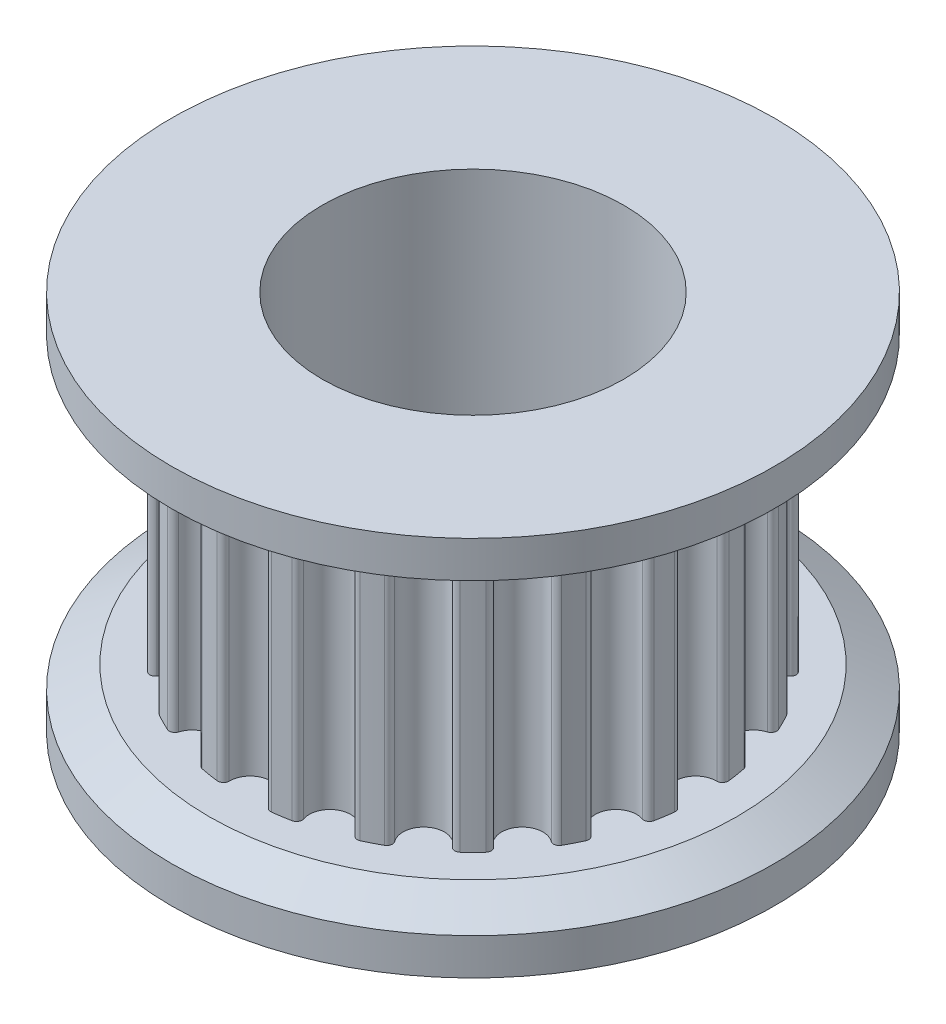
from build123d import *
from OCP.BRepFilletAPI import BRepFilletAPI_MakeChamfer

# Parameters (mm, degrees)
SKETCH_1_R               = 8
SKETCH_1_R_2             = 2.5
EXTRUDE_1_DEPTH          = 7.45
SKETCH_2_R               = 2.5
EXTRUDE_2_DEPTH          = 7
SKETCH_3_R               = 8
SKETCH_3_R_2             = 2.5
EXTRUDE_3_DEPTH          = 1.55
CUT_EXTRUDE_1_REACH      = 21.596
CUT_EXTRUDE_1_END_RADIUS = 8
SKETCH_4_R               = 1.25
CUT_EXTRUDE_2_REACH      = 21.596
CUT_EXTRUDE_2_END_RADIUS = 8
SKETCH_5_R               = 1.25
CHAMFER_1_SIZE           = 1
CHAMFER_1_SIZE2          = 0.577350269
ESBO_O1_R                = 8
CORTE_EXTRUS_O1_DEPTH    = 5.9
ESBO_O2_R                = 4
CORTE_EXTRUS_O2_DEPTH    = 10.1


with BuildPart() as part:
    # Эскиз1 → Бобышка-Вытянуть1 (new body)
    with BuildSketch(Plane(origin=(0, 0, 0), x_dir=(1, 0, 0), z_dir=(0, 1, 0))):
        with Locations(Location((0, 0, 0), (0, 0, 270))):
            Circle(SKETCH_1_R)
        with Locations(Location((0, 0, 0), (0, 0, 270))):
            Circle(SKETCH_1_R_2, mode=Mode.SUBTRACT)
    extrude(amount=EXTRUDE_1_DEPTH)

    # Эскиз2 → Бобышка-Вытянуть2 (add)
    with BuildSketch(Plane(origin=(0, 7.45, 0), x_dir=(1, 0, 0), z_dir=(0, 1, 0))):
        with BuildLine():
            ThreePointArc((-2.557469435, 5.549004423), (-2.773881953, 5.444049863), (-2.985996064, 5.3306592))
            ThreePointArc((-2.985996064, 5.3306592), (-3.059404709, 5.231014138), (-3.032930262, 5.110113057))
            ThreePointArc((-3.032930262, 5.110113057), (-3.150528952, 4.33633109), (-3.922779328, 4.463599867))
            ThreePointArc((-3.922779328, 4.463599867), (-4.029582035, 4.526139051), (-4.14703464, 4.487115298))
            ThreePointArc((-4.14703464, 4.487115298), (-4.320422433, 4.320422433), (-4.487115298, 4.14703464))
            ThreePointArc((-4.487115298, 4.14703464), (-4.526139051, 4.029582035), (-4.463599867, 3.922779328))
            ThreePointArc((-4.463599867, 3.922779328), (-4.33633109, 3.150528952), (-5.110113057, 3.032930262))
            ThreePointArc((-5.110113057, 3.032930262), (-5.231014138, 3.059404709), (-5.3306592, 2.985996064))
            ThreePointArc((-5.3306592, 2.985996064), (-5.444049863, 2.773881953), (-5.549004423, 2.557469435))
            ThreePointArc((-5.549004423, 2.557469435), (-5.549823367, 2.433706366), (-5.457341217, 2.351456627))
            ThreePointArc((-5.457341217, 2.351456627), (-5.097662927, 1.65633109), (-5.797233315, 1.305376312))
            ThreePointArc((-5.797233315, 1.305376312), (-5.92039813, 1.293194518), (-5.992481697, 1.19258673))
            ThreePointArc((-5.992481697, 1.19258673), (-6.034775761, 0.955814581), (-6.067718334, 0.717561302))
            ThreePointArc((-6.067718334, 0.717561302), (-6.030252304, 0.599602562), (-5.916879985, 0.549956967))
            ThreePointArc((-5.916879985, 0.549956967), (-5.36, 0), (-5.916879985, -0.549956967))
            ThreePointArc((-5.916879985, -0.549956967), (-6.030252304, -0.599602562), (-6.067718334, -0.717561302))
            ThreePointArc((-6.067718334, -0.717561302), (-6.034775761, -0.955814581), (-5.992481697, -1.19258673))
            ThreePointArc((-5.992481697, -1.19258673), (-5.92039813, -1.293194518), (-5.797233315, -1.305376312))
            ThreePointArc((-5.797233315, -1.305376312), (-5.097662927, -1.65633109), (-5.457341217, -2.351456627))
            ThreePointArc((-5.457341217, -2.351456627), (-5.549823367, -2.433706366), (-5.549004423, -2.557469435))
            ThreePointArc((-5.549004423, -2.557469435), (-5.444049863, -2.773881953), (-5.3306592, -2.985996064))
            ThreePointArc((-5.3306592, -2.985996064), (-5.231014138, -3.059404709), (-5.110113057, -3.032930262))
            ThreePointArc((-5.110113057, -3.032930262), (-4.33633109, -3.150528952), (-4.463599867, -3.922779328))
            ThreePointArc((-4.463599867, -3.922779328), (-4.526139051, -4.029582035), (-4.487115298, -4.14703464))
            ThreePointArc((-4.487115298, -4.14703464), (-4.320422433, -4.320422433), (-4.14703464, -4.487115298))
            ThreePointArc((-4.14703464, -4.487115298), (-4.029582035, -4.526139051), (-3.922779328, -4.463599867))
            ThreePointArc((-3.922779328, -4.463599867), (-3.150528952, -4.33633109), (-3.032930262, -5.110113057))
            ThreePointArc((-3.032930262, -5.110113057), (-3.059404709, -5.231014138), (-2.985996064, -5.3306592))
            ThreePointArc((-2.985996064, -5.3306592), (-2.773881953, -5.444049863), (-2.557469435, -5.549004423))
            ThreePointArc((-2.557469435, -5.549004423), (-2.433706366, -5.549823367), (-2.351456627, -5.457341217))
            ThreePointArc((-2.351456627, -5.457341217), (-1.65633109, -5.097662927), (-1.305376312, -5.797233315))
            ThreePointArc((-1.305376312, -5.797233315), (-1.293194518, -5.92039813), (-1.19258673, -5.992481697))
            ThreePointArc((-1.19258673, -5.992481697), (-0.955814581, -6.034775761), (-0.717561302, -6.067718334))
            ThreePointArc((-0.717561302, -6.067718334), (-0.599602562, -6.030252304), (-0.549956967, -5.916879985))
            ThreePointArc((-0.549956967, -5.916879985), (0, -5.36), (0.549956967, -5.916879985))
            ThreePointArc((0.549956967, -5.916879985), (0.599602562, -6.030252304), (0.717561302, -6.067718334))
            ThreePointArc((0.717561302, -6.067718334), (0.955814581, -6.034775761), (1.19258673, -5.992481697))
            ThreePointArc((1.19258673, -5.992481697), (1.293194518, -5.92039813), (1.305376312, -5.797233315))
            ThreePointArc((1.305376312, -5.797233315), (1.65633109, -5.097662927), (2.351456627, -5.457341217))
            ThreePointArc((2.351456627, -5.457341217), (2.433706366, -5.549823367), (2.557469435, -5.549004423))
            ThreePointArc((2.557469435, -5.549004423), (2.773881953, -5.444049863), (2.985996064, -5.3306592))
            ThreePointArc((2.985996064, -5.3306592), (3.059404709, -5.231014138), (3.032930262, -5.110113057))
            ThreePointArc((3.032930262, -5.110113057), (3.150528952, -4.33633109), (3.922779328, -4.463599867))
            ThreePointArc((3.922779328, -4.463599867), (4.029582035, -4.526139051), (4.14703464, -4.487115298))
            ThreePointArc((4.14703464, -4.487115298), (4.320422433, -4.320422433), (4.487115298, -4.14703464))
            ThreePointArc((4.487115298, -4.14703464), (4.526139051, -4.029582035), (4.463599867, -3.922779328))
            ThreePointArc((4.463599867, -3.922779328), (4.33633109, -3.150528952), (5.110113057, -3.032930262))
            ThreePointArc((5.110113057, -3.032930262), (5.231014138, -3.059404709), (5.3306592, -2.985996064))
            ThreePointArc((5.3306592, -2.985996064), (5.444049863, -2.773881953), (5.549004423, -2.557469435))
            ThreePointArc((5.549004423, -2.557469435), (5.549823367, -2.433706366), (5.457341217, -2.351456627))
            ThreePointArc((5.457341217, -2.351456627), (5.097662927, -1.65633109), (5.797233315, -1.305376312))
            ThreePointArc((5.797233315, -1.305376312), (5.92039813, -1.293194518), (5.992481697, -1.19258673))
            ThreePointArc((5.992481697, -1.19258673), (6.034775761, -0.955814581), (6.067718334, -0.717561302))
            ThreePointArc((6.067718334, -0.717561302), (6.030252304, -0.599602562), (5.916879985, -0.549956967))
            ThreePointArc((5.916879985, -0.549956967), (5.36, 0), (5.916879985, 0.549956967))
            ThreePointArc((5.916879985, 0.549956967), (6.030252304, 0.599602562), (6.067718334, 0.717561302))
            ThreePointArc((6.067718334, 0.717561302), (6.034775761, 0.955814581), (5.992481697, 1.19258673))
            ThreePointArc((5.992481697, 1.19258673), (5.92039813, 1.293194518), (5.797233315, 1.305376312))
            ThreePointArc((5.797233315, 1.305376312), (5.097662927, 1.65633109), (5.457341217, 2.351456627))
            ThreePointArc((5.457341217, 2.351456627), (5.549823367, 2.433706366), (5.549004423, 2.557469435))
            ThreePointArc((5.549004423, 2.557469435), (5.444049863, 2.773881953), (5.3306592, 2.985996064))
            ThreePointArc((5.3306592, 2.985996064), (5.231014138, 3.059404709), (5.110113057, 3.032930262))
            ThreePointArc((5.110113057, 3.032930262), (4.33633109, 3.150528952), (4.463599867, 3.922779328))
            ThreePointArc((4.463599867, 3.922779328), (4.526139051, 4.029582035), (4.487115298, 4.14703464))
            ThreePointArc((4.487115298, 4.14703464), (4.320422433, 4.320422433), (4.14703464, 4.487115298))
            ThreePointArc((4.14703464, 4.487115298), (4.029582035, 4.526139051), (3.922779328, 4.463599867))
            ThreePointArc((3.922779328, 4.463599867), (3.150528952, 4.33633109), (3.032930262, 5.110113057))
            ThreePointArc((3.032930262, 5.110113057), (3.059404709, 5.231014138), (2.985996064, 5.3306592))
            ThreePointArc((2.985996064, 5.3306592), (2.773881953, 5.444049863), (2.557469435, 5.549004423))
            ThreePointArc((2.557469435, 5.549004423), (2.433706366, 5.549823367), (2.351456627, 5.457341217))
            ThreePointArc((2.351456627, 5.457341217), (1.65633109, 5.097662927), (1.305376312, 5.797233315))
            ThreePointArc((1.305376312, 5.797233315), (1.293194518, 5.92039813), (1.19258673, 5.992481697))
            ThreePointArc((1.19258673, 5.992481697), (0.955814581, 6.034775761), (0.717561302, 6.067718334))
            ThreePointArc((0.717561302, 6.067718334), (0.599602562, 6.030252304), (0.549956967, 5.916879985))
            ThreePointArc((0.549956967, 5.916879985), (0, 5.36), (-0.549956967, 5.916879985))
            ThreePointArc((-0.549956967, 5.916879985), (-0.599602562, 6.030252304), (-0.717561302, 6.067718334))
            ThreePointArc((-0.717561302, 6.067718334), (-0.955814581, 6.034775761), (-1.19258673, 5.992481697))
            ThreePointArc((-1.19258673, 5.992481697), (-1.293194518, 5.92039813), (-1.305376312, 5.797233315))
            ThreePointArc((-1.305376312, 5.797233315), (-1.65633109, 5.097662927), (-2.351456627, 5.457341217))
            ThreePointArc((-2.351456627, 5.457341217), (-2.433706366, 5.549823367), (-2.557469435, 5.549004423))
        make_face()
        with Locations(Location((0, 0, 0), (0, 0, 270))):
            Circle(SKETCH_2_R, mode=Mode.SUBTRACT)
    extrude(amount=EXTRUDE_2_DEPTH)

    # Эскиз3 → Бобышка-Вытянуть3 (add)
    with BuildSketch(Plane(origin=(0, 14.45, 0), x_dir=(1, 0, 0), z_dir=(0, 1, 0))):
        with Locations(Location((0, 0, 0), (0, 0, 270))):
            Circle(SKETCH_3_R)
        with Locations(Location((0, 0, 0), (0, 0, 270))):
            Circle(SKETCH_3_R_2, mode=Mode.SUBTRACT)
    extrude(amount=EXTRUDE_3_DEPTH)

    # Вырез-Вытянуть1: up to this cylinder (the profile starts inside it)
    cut_extrude_1_end = Plane(origin=(0, 3.725, 0), z_dir=(0, -1, 0)) * Cylinder(CUT_EXTRUDE_1_END_RADIUS, 60.192, mode=Mode.PRIVATE)
    # Эскиз4 → Вырез-Вытянуть1 (cut, up to the surface)
    with BuildSketch(Plane.XY, mode=Mode.PRIVATE) as cut_extrude_1_sk1:
        with Locations(Location((0, 3.725, 0), (0, 0, 180))):
            Circle(SKETCH_4_R)
    cut_extrude_1_tool1 = extrude(cut_extrude_1_sk1.sketch, amount=CUT_EXTRUDE_1_REACH, mode=Mode.PRIVATE) & cut_extrude_1_end
    add(cut_extrude_1_tool1.solids().sort_by_distance((0, 3.725, 0))[0], mode=Mode.SUBTRACT)

    # Вырез-Вытянуть2: up to this cylinder (the profile starts inside it)
    cut_extrude_2_end = Plane(origin=(0, 3.725, 0), z_dir=(0, -1, 0)) * Cylinder(CUT_EXTRUDE_2_END_RADIUS, 60.192, mode=Mode.PRIVATE)
    # Эскиз5 → Вырез-Вытянуть2 (cut, up to the surface)
    with BuildSketch(Plane(origin=(0, 0, 0), x_dir=(0, 0, -1), z_dir=(1, 0, 0)), mode=Mode.PRIVATE) as cut_extrude_2_sk1:
        with Locations(Location((0, 3.725, 0), (0, 0, 180))):
            Circle(SKETCH_5_R)
    cut_extrude_2_tool1 = extrude(cut_extrude_2_sk1.sketch, amount=CUT_EXTRUDE_2_REACH, mode=Mode.PRIVATE) & cut_extrude_2_end
    add(cut_extrude_2_tool1.solids().sort_by_distance((0, 3.725, 0))[0], mode=Mode.SUBTRACT)

    # Фаска1: one chamfer whose edges measure the first distance from different faces: ONE call of the kernel's chamfer builder (chamfer() names one face for all edges)
    chamfer_1_edges_1 = [part.edges().sort_by_distance(p)[0] for p in [
        (0, 14.45, -8),
    ]]
    chamfer_1_side_1 = [part.faces().sort_by_distance(p)[0] for p in [
        (0, 14.45, -7.77372583),
    ]]
    chamfer_1_edges_2 = [part.edges().sort_by_distance(p)[0] for p in [
        (0, 7.45, -8),
    ]]
    chamfer_1_side_2 = [part.faces().sort_by_distance(p)[0] for p in [
        (0, 7.45, -7.77372583),
    ]]
    chamfer_1 = BRepFilletAPI_MakeChamfer(part.part.solid().wrapped)
    for e in chamfer_1_edges_1:
        chamfer_1.Add(CHAMFER_1_SIZE, CHAMFER_1_SIZE2, e.wrapped, chamfer_1_side_1[0].wrapped)  # the first distance lies on this face
    for e in chamfer_1_edges_2:
        chamfer_1.Add(CHAMFER_1_SIZE, CHAMFER_1_SIZE2, e.wrapped, chamfer_1_side_2[0].wrapped)  # the first distance lies on this face
    add(Compound.cast(chamfer_1.Shape()), mode=Mode.REPLACE)

    # Esboço1 → Corte-extrusão1 (cut)
    with BuildSketch(Plane.XZ):
        with Locations(Location((0, 0, 0), (0, 0, 270))):
            Circle(ESBO_O1_R)
    extrude(amount=-CORTE_EXTRUS_O1_DEPTH, mode=Mode.SUBTRACT)

    # Esboço2 → Corte-extrusão2 (cut)
    with BuildSketch(Plane(origin=(0, 16, 0), x_dir=(1, 0, 0), z_dir=(0, 1, 0))):
        with Locations(Location((0, 0, 0), (0, 0, 270))):
            Circle(ESBO_O2_R)
    extrude(amount=-CORTE_EXTRUS_O2_DEPTH, mode=Mode.SUBTRACT)


solid = part.part
